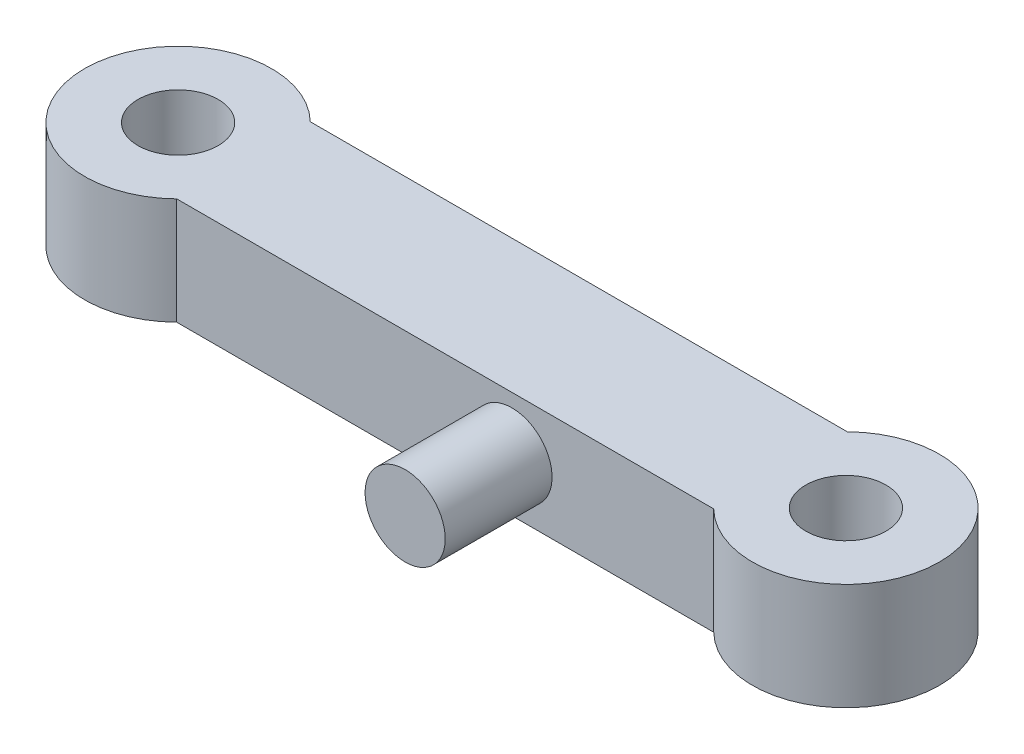
from build123d import *

# Parameters (mm, degrees)
SKETCH_1_R      = 1.5
EXTRUDE_1_DEPTH = 4
SKETCH_2_R      = 1.5
EXTRUDE_2_DEPTH = 4


with BuildPart() as part:
    # Эскиз1 → Бобышка-Вытянуть1 (new body)
    with BuildSketch(Plane(origin=(0, 0, 0), x_dir=(1, 0, 0), z_dir=(0, 1, 0))):
        with BuildLine():
            Line((-10.050510257, -2.5), (10.050510257, -2.5))
            ThreePointArc((10.050510257, -2.5), (16, 0), (10.050510257, 2.5))
            Line((10.050510257, 2.5), (-10.050510257, 2.5))
            ThreePointArc((-10.050510257, 2.5), (-16, 0), (-10.050510257, -2.5))
        make_face()
        with Locations(Location((-12.5, 0, 0), (0, 0, 270))):
            Circle(SKETCH_1_R, mode=Mode.SUBTRACT)
        with Locations(Location((12.5, 0, 0), (0, 0, 270))):
            Circle(SKETCH_1_R, mode=Mode.SUBTRACT)
    extrude(amount=EXTRUDE_1_DEPTH)

    # Эскиз2 → Бобышка-Вытянуть2 (add)
    with BuildSketch(Plane.XY.offset(2.5)):
        with Locations(Location((2.5, 2, 0), (0, 0, 180))):
            Circle(SKETCH_2_R)
    extrude(amount=EXTRUDE_2_DEPTH)


solid = part.part
